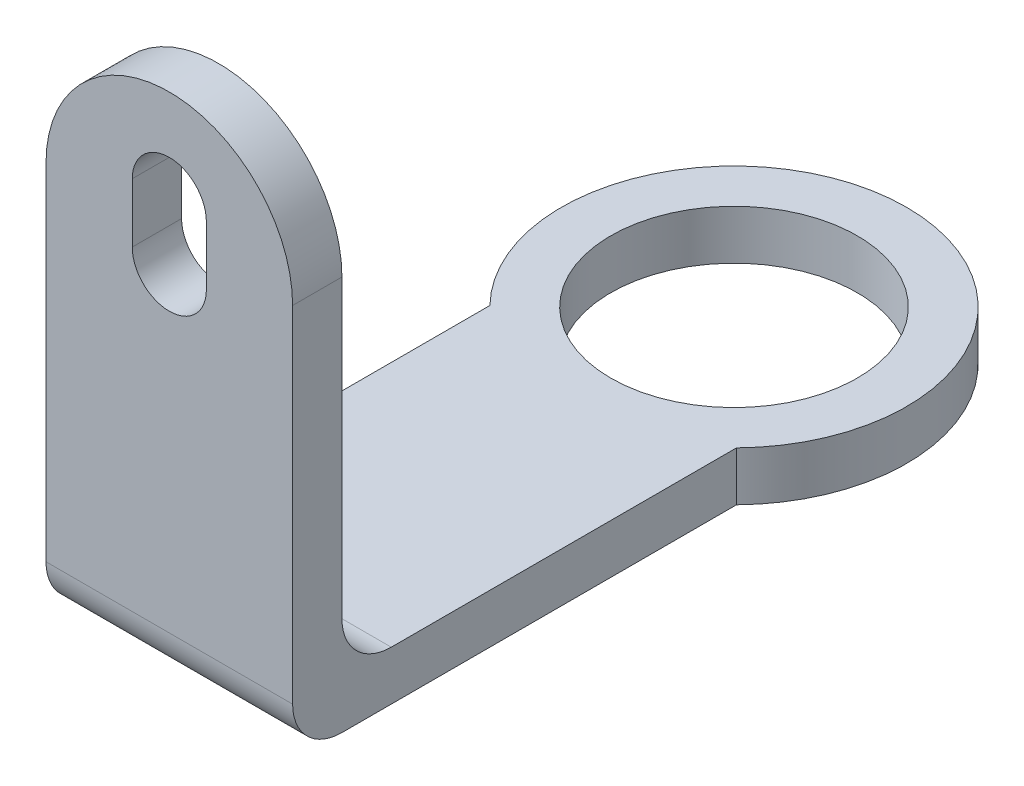
from build123d import *

# Parameters (mm, degrees)
SKETCH_1_R      = 2.5
EXTRUDE_2_DEPTH = 1
EXTRUDE_3_DEPTH = 1
FILLET_1_R      = 1


with BuildPart() as part:
    # Эскиз1 → Бобышка-Вытянуть2 (new body)
    with BuildSketch(Plane(origin=(0, 0, 0), x_dir=(1, 0, 0), z_dir=(0, 1, 0))):
        with BuildLine():
            Line((-2.5, -2.449489743), (-2.5, -10.449489743))
            Line((-2.5, -10.449489743), (2.5, -10.449489743))
            Line((2.5, -10.449489743), (2.5, -2.449489743))
            ThreePointArc((2.5, -2.449489743), (0, 3.5), (-2.5, -2.449489743))
        make_face()
        with Locations(Location((0, 0, 0), (0, 0, 270))):
            Circle(SKETCH_1_R, mode=Mode.SUBTRACT)
    extrude(amount=EXTRUDE_2_DEPTH)

    # Эскиз3 → Бобышка-Вытянуть3 (add)
    with BuildSketch(Plane.XY.offset(10.449489743)):
        with BuildLine():
            Line((2.5, 0), (-2.5, 0))
            Line((-2.5, 0), (-2.5, 8))
            ThreePointArc((-2.5, 8), (0, 10.5), (2.5, 8))
            Line((2.5, 8), (2.5, 0))
        make_face()
        with BuildLine():
            Line((-0.751190727, 7.4), (-0.751190727, 8.6))
            ThreePointArc((-0.751190727, 8.6), (0, 9.351190727), (0.751190727, 8.6))
            Line((0.751190727, 8.6), (0.751190727, 7.4))
            ThreePointArc((0.751190727, 7.4), (0, 6.648809273), (-0.751190727, 7.4))
        make_face(mode=Mode.SUBTRACT)
    extrude(amount=EXTRUDE_3_DEPTH)

    # Скругление1
    fillet_1_edges = [part.edges().sort_by_distance(p)[0] for p in [
        (0, 0, 11.449489743),
        (0, 1, 10.449489743),
    ]]
    fillet(fillet_1_edges, radius=FILLET_1_R)


solid = part.part
